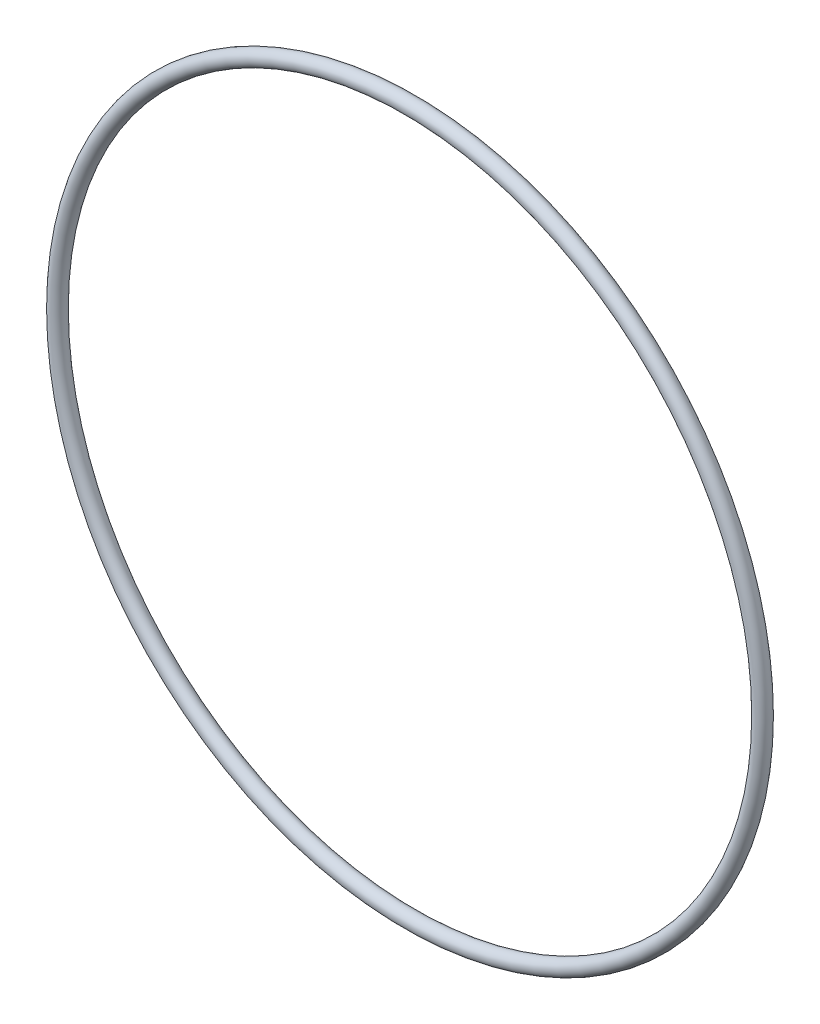
from build123d import *

# Parameters (mm, degrees)
SKETCH1_R = 1.5


with BuildPart() as part:
    # Sketch1 → Revolve1 (revolve)
    with BuildSketch(Plane(origin=(0, 0, 0), x_dir=(0, 0, -1), z_dir=(1, 0, 0))):
        with Locations((0, 68.75)):
            Circle(SKETCH1_R)
    revolve(axis=Axis((0, 0, 0), (0, 0, 1)))


solid = part.part
